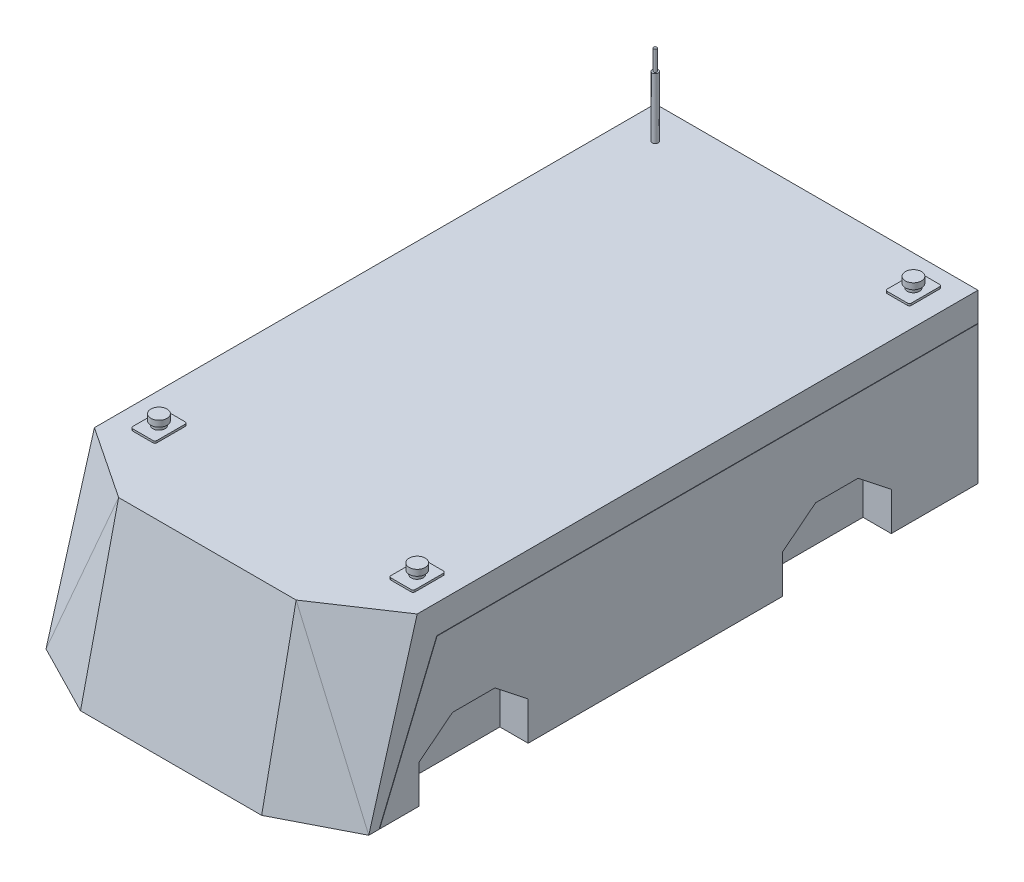
from build123d import *

# Parameters (mm, degrees)
CROQUIS1_W              = 800
CROQUIS1_H              = 1600
SALIENTE_EXTRUIR1_DEPTH = 415
CORTAR_EXTRUIR1_DEPTH   = 200
CORTAR_EXTRUIR2_DEPTH   = 200
CORTAR_EXTRUIR6_DEPTH   = 499
CORTAR_EXTRUIR8_DEPTH   = 359
CORTAR_EXTRUIR10_DEPTH  = 353
CORTAR_EXTRUIR12_DEPTH  = 514
CORTAR_EXTRUIR13_DEPTH  = 514
CORTAR_EXTRUIR16_DEPTH  = 70
CORTAR_EXTRUIR17_DEPTH  = 70
CORTAR_EXTRUIR18_DEPTH  = 1
CROQUIS20_W             = 800
CROQUIS20_H             = 1
CORTAR_EXTRUIR19_DEPTH  = 1
SALIENTE_EXTRUIR2_DEPTH = 5
CROQUIS22_R             = 15
SALIENTE_EXTRUIR3_DEPTH = 10
CROQUIS23_R             = 20
SALIENTE_EXTRUIR4_DEPTH = 15
SALIENTE_EXTRUIR5_DEPTH = 5
CROQUIS26_R             = 25
SALIENTE_EXTRUIR6_DEPTH = 75


with BuildPart() as part:
    # Croquis1 → Saliente-Extruir1 (new body)
    with BuildSketch(Plane(origin=(0, 0, 0), x_dir=(1, 0, 0), z_dir=(0, 1, 0))):
        with Locations((0, -407.98258177)):
            Rectangle(CROQUIS1_W, CROQUIS1_H)
    extrude(amount=SALIENTE_EXTRUIR1_DEPTH)

    # Croquis3 → Cortar-Extruir1 (cut)
    with BuildSketch(Plane(origin=(604.100569287, 262.019524028, 906.150853931), x_dir=(-0.8421068082275548, 0.1498081502111445, 0.5180865194802076), z_dir=(-0.5393107856670403, -0.23391793113269235, -0.8089661785005605))):
        Polygon((456.118589156, 88.118028239), (242.368981337, -310.549885139), (242.368981337, 121.451272267), align=None)
    extrude(amount=-CORTAR_EXTRUIR1_DEPTH, mode=Mode.SUBTRACT)

    # Croquis5 → Cortar-Extruir2 (cut)
    with BuildSketch(Plane(origin=(-604.100569287, 262.019524028, 906.150853931), x_dir=(-0.8421068082275548, -0.1498081502111445, -0.5180865194802076), z_dir=(0.5393107856670404, -0.2339179311326923, -0.8089661785005605))):
        Polygon((-242.368981337, -310.549885139), (-242.368981337, 121.451272267), (-456.118589156, 88.118028239), align=None)
    extrude(amount=-CORTAR_EXTRUIR2_DEPTH, mode=Mode.SUBTRACT)

    # Croquis8 → Cortar-Extruir6 (cut)
    with BuildSketch(Plane(origin=(0, 250.204627362, 1153.721337281), x_dir=(-1, 0, 0), z_dir=(0, -0.21194078521367435, -0.9772825095963864))):
        Polygon((220, 168.626135247), (400, -256.020776905), (-400, -256.020776905), (-220, 168.626135247), (0, 168.626135247), align=None)
    extrude(amount=-CORTAR_EXTRUIR6_DEPTH, mode=Mode.SUBTRACT)

    # Croquis12 → Cortar-Extruir8 (cut)
    with BuildSketch(Plane.XY.offset(1117.98258177)):
        Polygon((220, 415), (400, 0), (400, 415), align=None)
    extrude(amount=CORTAR_EXTRUIR8_DEPTH, mode=Mode.SUBTRACT)

    # Croquis14 → Cortar-Extruir10 (cut)
    with BuildSketch(Plane.XY.offset(1117.98258177)):
        Polygon((-220, 415), (-400, 0), (-400, 415), align=None)
    extrude(amount=CORTAR_EXTRUIR10_DEPTH, mode=Mode.SUBTRACT)

    # Croquis15 → Cortar-Extruir12 (cut)
    with BuildSketch(Plane(origin=(516.98244579, 224.233349981, 1008.11576929), x_dir=(-0.8942171635698928, 0.0971910742249457, 0.4369548712029846), z_dir=(-0.44763340400043405, -0.19415424751826063, -0.8728851378008463))):
        Polygon((327.082120211, -262.279632659), (130.821069596, -242.738649788), (332.114454842, 162.361304614), align=None)
    extrude(amount=-CORTAR_EXTRUIR12_DEPTH, mode=Mode.SUBTRACT)


with BuildPart() as body_2:
    # of the pieces the cut leaves, the one that is kept (cortar_extruir12_keep)
    add(part.part.solids().sort_by_distance((-400, 0, 1207.98258177))[0])

    # Croquis16 → Cortar-Extruir13 (cut)
    with BuildSketch(Plane(origin=(-516.98244579, 224.233349981, 1008.11576929), x_dir=(-0.8942171635698928, -0.09719107422494568, -0.43695487120298454), z_dir=(0.44763340400043394, -0.19415424751826066, -0.8728851378008463))):
        Polygon((-327.082120211, -262.279632659), (-332.114454842, 162.361304614), (-130.821069596, -242.738649788), align=None)
    extrude(amount=-CORTAR_EXTRUIR13_DEPTH, mode=Mode.SUBTRACT)


with BuildPart() as body_2_2:
    # of the pieces the cut leaves, the one that is kept (cortar_extruir13_keep)
    add(body_2.part.solids().sort_by_distance((224.5, 0, 1207.98258177))[0])

    # Croquis17 → Cortar-Extruir16 (cut)
    with BuildSketch(Plane(origin=(400, 0, 0), x_dir=(0, 0, -1), z_dir=(1, 0, 0))):
        Polygon((177.01741823, 0), (-92.98258177, 0), (-92.98258177, 95), (-10.48258177, 160), (94.51741823, 160), (177.01741823, 95), align=None)
        Polygon((-992.98258177, 0), (-722.98258177, 0), (-722.98258177, 95), (-805.48258177, 160), (-910.48258177, 160), (-992.98258177, 95), align=None)
    extrude(amount=-CORTAR_EXTRUIR16_DEPTH, mode=Mode.SUBTRACT)

    # Croquis18 → Cortar-Extruir17 (cut)
    with BuildSketch(Plane.ZY.offset(400)):
        Polygon((-177.01741823, 0), (82.98258177, 0), (82.98258177, 95), (5.48258177, 160), (-99.51741823, 160), (-177.01741823, 95), align=None)
        Polygon((992.98258177, 0), (732.98258177, 0), (732.98258177, 95), (810.48258177, 160), (915.48258177, 160), (992.98258177, 95), align=None)
    extrude(amount=-CORTAR_EXTRUIR17_DEPTH, mode=Mode.SUBTRACT)

    # Croquis19 → Cortar-Extruir18 (cut)
    with BuildSketch(Plane(origin=(400, 0, 0), x_dir=(0, 0, -1), z_dir=(1, 0, 0))):
        Polygon((392.01741823, 343), (-948.718987098, 343), (-1091.223533976, 0), (-1092.306405756, 0), (-949.386393727, 344), (392.01741823, 344), align=None)
    cortar_extruir18 = extrude(amount=-CORTAR_EXTRUIR18_DEPTH, mode=Mode.SUBTRACT)

    # Croquis20 → Cortar-Extruir19 (cut)
    with BuildSketch(Plane(origin=(0, 0, -392.01741823), x_dir=(-1, 0, 0), z_dir=(0, 0, -1))):
        with Locations((0, 343.5)):
            Rectangle(CROQUIS20_W, CROQUIS20_H)
    extrude(amount=-CORTAR_EXTRUIR19_DEPTH, mode=Mode.SUBTRACT)

    # Simetría1: Cortar-Extruir18 across plane
    add(cortar_extruir18.mirror(Plane.ZY), mode=Mode.SUBTRACT)

    # Croquis21 → Saliente-Extruir2 (add)
    with BuildSketch(Plane(origin=(0, 415, 0), x_dir=(1, 0, 0), z_dir=(0, 1, 0))):
        with BuildLine():
            Line((295, 272.01741823), (345, 272.01741823))
            ThreePointArc((345, 272.01741823), (348.535533906, 273.481884325), (350, 277.01741823))
            Line((350, 277.01741823), (350, 347.01741823))
            ThreePointArc((350, 347.01741823), (348.535533906, 350.552952136), (345, 352.01741823))
            Line((345, 352.01741823), (295, 352.01741823))
            ThreePointArc((295, 352.01741823), (291.464466094, 350.552952136), (290, 347.01741823))
            Line((290, 347.01741823), (290, 277.01741823))
            ThreePointArc((290, 277.01741823), (291.464466094, 273.481884325), (295, 272.01741823))
        make_face()
        with BuildLine():
            Line((290, -882.98258177), (290, -952.98258177))
            ThreePointArc((290, -952.98258177), (291.464466094, -956.518115675), (295, -957.98258177))
            Line((295, -957.98258177), (345, -957.98258177))
            ThreePointArc((345, -957.98258177), (348.535533906, -956.518115675), (350, -952.98258177))
            Line((350, -952.98258177), (350, -882.98258177))
            ThreePointArc((350, -882.98258177), (348.535533906, -879.447047864), (345, -877.98258177))
            Line((345, -877.98258177), (295, -877.98258177))
            ThreePointArc((295, -877.98258177), (291.464466094, -879.447047864), (290, -882.98258177))
        make_face()
        with BuildLine():
            Line((-295, -877.98258177), (-345, -877.98258177))
            ThreePointArc((-345, -877.98258177), (-348.535533906, -879.447047864), (-350, -882.98258177))
            Line((-350, -882.98258177), (-350, -952.98258177))
            ThreePointArc((-350, -952.98258177), (-348.535533906, -956.518115675), (-345, -957.98258177))
            Line((-345, -957.98258177), (-295, -957.98258177))
            ThreePointArc((-295, -957.98258177), (-291.464466094, -956.518115675), (-290, -952.98258177))
            Line((-290, -952.98258177), (-290, -882.98258177))
            ThreePointArc((-290, -882.98258177), (-291.464466094, -879.447047864), (-295, -877.98258177))
        make_face()
    extrude(amount=SALIENTE_EXTRUIR2_DEPTH)

    # Croquis22 → Saliente-Extruir3 (add)
    with BuildSketch(Plane(origin=(0, 420, 0), x_dir=(1, 0, 0), z_dir=(0, 1, 0))):
        with Locations((320, 312.01741823)):
            Circle(CROQUIS22_R)
        with Locations((320, -917.98258177)):
            Circle(CROQUIS22_R)
        with Locations((-320, -917.98258177)):
            Circle(CROQUIS22_R)
    extrude(amount=SALIENTE_EXTRUIR3_DEPTH)

    # Croquis23 → Saliente-Extruir4 (add)
    with BuildSketch(Plane(origin=(0, 430, 0), x_dir=(1, 0, 0), z_dir=(0, 1, 0))):
        with Locations((320, 312.01741823)):
            Circle(CROQUIS23_R)
        with Locations((320, -917.98258177)):
            Circle(CROQUIS23_R)
        with Locations((-320, -917.98258177)):
            Circle(CROQUIS23_R)
    extrude(amount=SALIENTE_EXTRUIR4_DEPTH)

    # Croquis25 → Saliente-Extruir5 (add)
    with BuildSketch(Plane.XZ):
        with BuildLine():
            Line((-30, -476.764876907), (-30, -392.01741823))
            Line((-30, -392.01741823), (30, -392.01741823))
            Line((30, -392.01741823), (30, -476.764876907))
            ThreePointArc((30, -476.764876907), (0, -506.764876907), (-30, -476.764876907))
        make_face()
    extrude(amount=-SALIENTE_EXTRUIR5_DEPTH)

    # Croquis26 → Saliente-Extruir6 (add)
    with BuildSketch(Plane(origin=(0, 5, 0), x_dir=(1, 0, 0), z_dir=(0, 1, 0))):
        with Locations((0, 476.764876907)):
            Circle(CROQUIS26_R)
    extrude(amount=SALIENTE_EXTRUIR6_DEPTH)

    # Croquis28 → Cortar-Revolución7 (revolve, cut)
    with BuildSketch(Plane.ZY):
        with BuildLine():
            Line((-451.764876907, 5), (-451.764876907, 55))
            ThreePointArc((-451.764876907, 55), (-454.267783945, 44.096752398), (-461.275341569, 35.376690009))
            add(Edge.make_bspline(
                [(-461.275341569, 35.376690009), (-479.429840017, 14.56995995), (-453.764876907, 5)],
                knots=[0, 0, 0, 1, 1, 1], degree=2))
            Line((-453.764876907, 5), (-451.764876907, 5))
        make_face()
    revolve(axis=Axis((0, 90.386786237, -476.764876907), (0, -1, 0)), mode=Mode.SUBTRACT)

    # Croquis29 → Cortar-Revolución26 (revolve, cut)
    with BuildSketch(Plane.ZY):
        with BuildLine():
            Line((-475.149447102, 80), (-475.149447102, 84.514502028))
            Line((-475.149447102, 84.514502028), (-446.334832781, 84.514502028))
            Line((-446.334832781, 84.514502028), (-446.334832781, 57.478552518))
            Line((-446.334832781, 57.478552518), (-451.764876907, 56.615429804))
            ThreePointArc((-451.764876907, 56.615429804), (-459.050340313, 72.714536594), (-475.149447102, 80))
        make_face()
    revolve(axis=Axis((0, 80, -476.764876907), (0, -1, 0)), mode=Mode.SUBTRACT)

    # Croquis30 → Revolución1 (revolve)
    with BuildSketch(Plane(origin=(0, 0, -312.01741823), x_dir=(-1, 0, 0), z_dir=(0, 0, -1))):
        Polygon((327.5, 415), (327.5, 565), (323.75, 565), (323.75, 615), (320, 615), (320, 415), align=None)
    revolve(axis=Axis((-320, 633.577098179, -312.01741823), (0, -1, 0)))


solid = body_2_2.part
